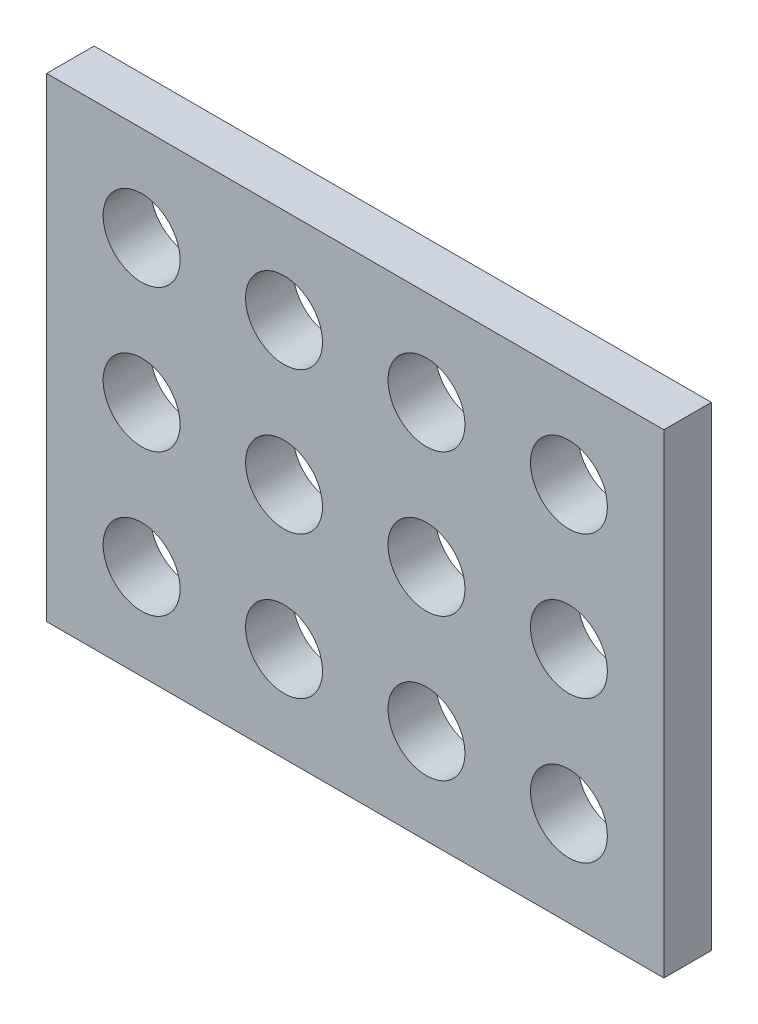
from build123d import *

# Parameters (mm, degrees)
CROQUIS1_W              = 130
CROQUIS1_H              = 100
CROQUIS1_R              = 8.1
SALIENTE_EXTRUIR1_DEPTH = 10


with BuildPart() as part:
    # Croquis1 → Saliente-Extruir1 (new body)
    with BuildSketch(Plane.XY):
        Rectangle(CROQUIS1_W, CROQUIS1_H)
        with Locations((-45, 30)):
            Circle(CROQUIS1_R, mode=Mode.SUBTRACT)
        with Locations((-15, 30)):
            Circle(CROQUIS1_R, mode=Mode.SUBTRACT)
        with Locations((15, 30)):
            Circle(CROQUIS1_R, mode=Mode.SUBTRACT)
        with Locations((45, 30)):
            Circle(CROQUIS1_R, mode=Mode.SUBTRACT)
        with Locations((-15, 0)):
            Circle(CROQUIS1_R, mode=Mode.SUBTRACT)
        with Locations((15, 0)):
            Circle(CROQUIS1_R, mode=Mode.SUBTRACT)
        with Locations((45, 0)):
            Circle(CROQUIS1_R, mode=Mode.SUBTRACT)
        with Locations((-15, -30)):
            Circle(CROQUIS1_R, mode=Mode.SUBTRACT)
        with Locations((15, -30)):
            Circle(CROQUIS1_R, mode=Mode.SUBTRACT)
        with Locations((45, -30)):
            Circle(CROQUIS1_R, mode=Mode.SUBTRACT)
        with Locations((-45, 0)):
            Circle(CROQUIS1_R, mode=Mode.SUBTRACT)
        with Locations((-45, -30)):
            Circle(CROQUIS1_R, mode=Mode.SUBTRACT)
    extrude(amount=SALIENTE_EXTRUIR1_DEPTH)


solid = part.part
